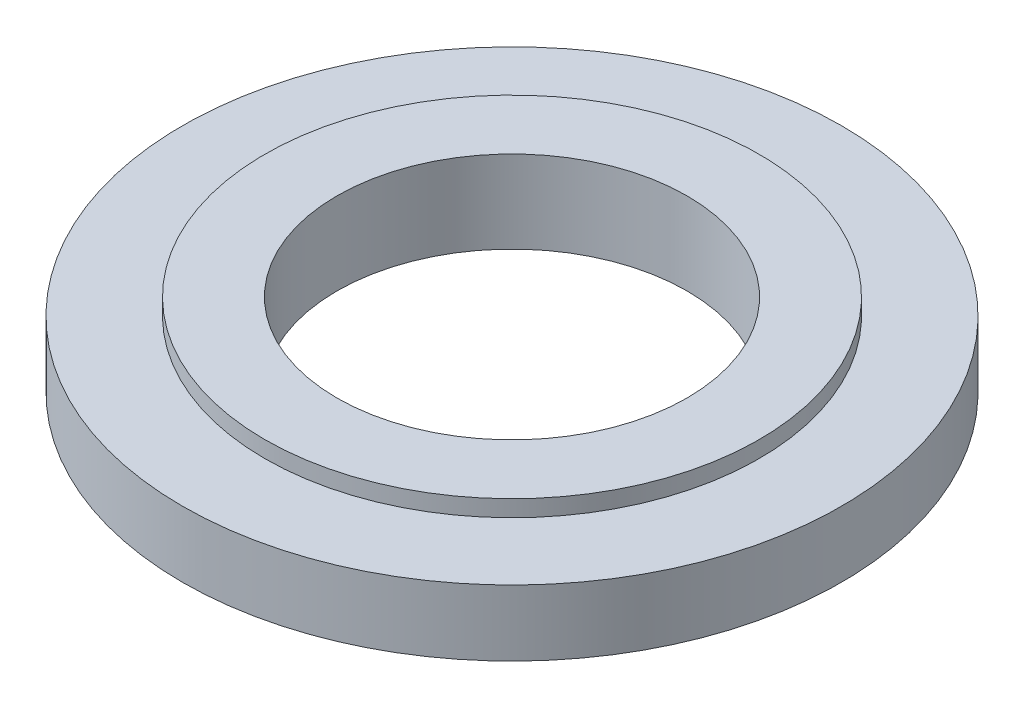
from build123d import *

# Parameters (mm, degrees)
CROQUIS1_R              = 4
CROQUIS1_R_2            = 2.125
SALIENTE_EXTRUIR1_DEPTH = 0.8
CROQUIS2_R              = 3
CROQUIS2_R_2            = 2.125
SALIENTE_EXTRUIR2_DEPTH = 0.2


with BuildPart() as part:
    # Croquis1 → Saliente-Extruir1 (new body)
    with BuildSketch(Plane(origin=(0, 0, 0), x_dir=(1, 0, 0), z_dir=(0, 1, 0))):
        with Locations(Location((0, 0, 0), (0, 0, 270))):
            Circle(CROQUIS1_R)
        with Locations(Location((0, 0, 0), (0, 0, 270))):
            Circle(CROQUIS1_R_2, mode=Mode.SUBTRACT)
    extrude(amount=SALIENTE_EXTRUIR1_DEPTH)

    # Croquis2 → Saliente-Extruir2 (add)
    with BuildSketch(Plane(origin=(0, 0.8, 0), x_dir=(1, 0, 0), z_dir=(0, 1, 0))):
        with Locations(Location((0, 0, 0), (0, 0, 270))):
            Circle(CROQUIS2_R)
        with Locations(Location((0, 0, 0), (0, 0, 270))):
            Circle(CROQUIS2_R_2, mode=Mode.SUBTRACT)
    extrude(amount=SALIENTE_EXTRUIR2_DEPTH)


solid = part.part
